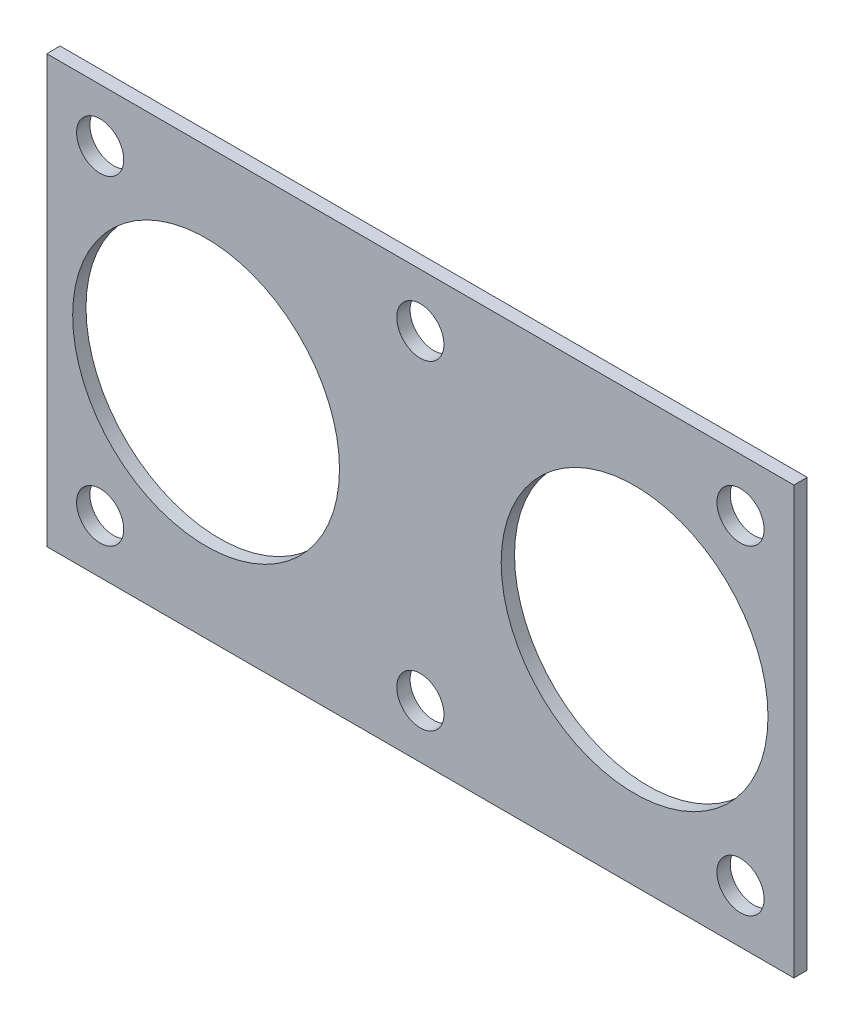
from build123d import *

# Parameters (mm, degrees)
SKETCH1_W              = 88.9
SKETCH1_H              = 50.8
SKETCH1_R              = 15.875
BOSS_EXTRUDE1_DEPTH    = 1.5875
F_10_CLEARANCE_HOLE1_D = 5.6134


with BuildPart() as part:
    # Sketch1 → Boss-Extrude1 (new body)
    with BuildSketch(Plane.XY):
        with Locations((25.49525, 0)):
            Rectangle(SKETCH1_W, SKETCH1_H)
        Circle(SKETCH1_R, mode=Mode.SUBTRACT)
        with Locations((50.9905, 0)):
            Circle(SKETCH1_R, mode=Mode.SUBTRACT)
    extrude(amount=BOSS_EXTRUDE1_DEPTH)

    # #10 Clearance Hole1 (through all)
    with Locations(Plane(origin=(-41.275, -44.45, 1.5875), x_dir=(1, 0, 0), z_dir=(0, 0, 1))):
        with Locations((104.87025, 63.5), (28.67025, 63.5), (66.77025, 25.4), (28.67025, 25.4), (66.77025, 63.5), (104.87025, 25.4)):
            Hole(F_10_CLEARANCE_HOLE1_D / 2)


solid = part.part
